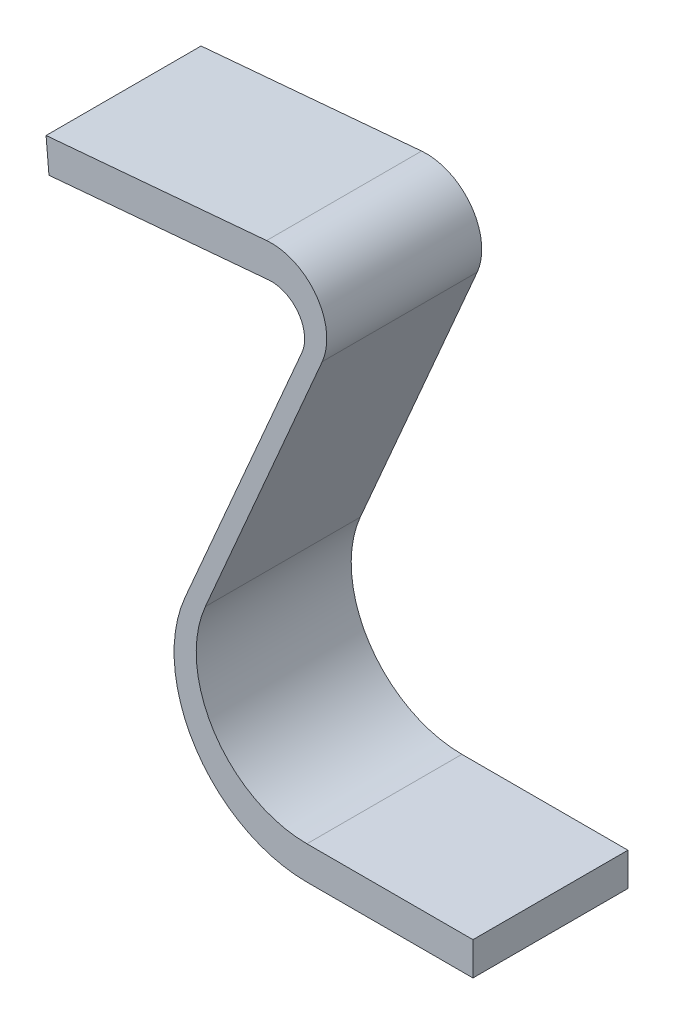
from build123d import *

# Parameters (mm, degrees)
BOSS_EXTRUDE1_DEPTH      = 7
BOSS_EXTRUDE1_DEPTH_BACK = 7


with BuildPart() as part:
    # Sketch1 → Boss-Extrude1 (new, two sides: drawn at the far end of the back side and taken through both)
    with BuildSketch(Plane.XY.offset(-BOSS_EXTRUDE1_DEPTH_BACK)):
        with BuildLine():
            Line((-17.458418155, -11.36484808), (2.465475807, -9.621733225))
            ThreePointArc((2.465475807, -9.621733225), (6.955793602, -11.676837129), (7.491085956, -16.585998774))
            Line((7.491085956, -16.585998774), (-3.072780906, -41.033415882))
            ThreePointArc((-3.072780906, -41.033415882), (-2.24972743, -50.492456592), (6.106881965, -55))
            Line((6.106881965, -55), (21.106881965, -55))
            Line((21.106881965, -55), (21.106881965, -58))
            Line((21.106881965, -58), (6.106881965, -58))
            ThreePointArc((6.106881965, -58), (-3.921049309, -52.59094791), (-4.908713481, -41.240099059))
            Line((-4.908713481, -41.240099059), (5.655153382, -16.79268195))
            ThreePointArc((5.655153382, -16.79268195), (5.333977969, -13.847184963), (2.639787292, -12.614122621))
            Line((2.639787292, -12.614122621), (-17.197282581, -14.349641352))
            Line((-17.197282581, -14.349641352), (-17.458418155, -11.36484808))
        make_face()
    extrude(amount=BOSS_EXTRUDE1_DEPTH + BOSS_EXTRUDE1_DEPTH_BACK)


solid = part.part
